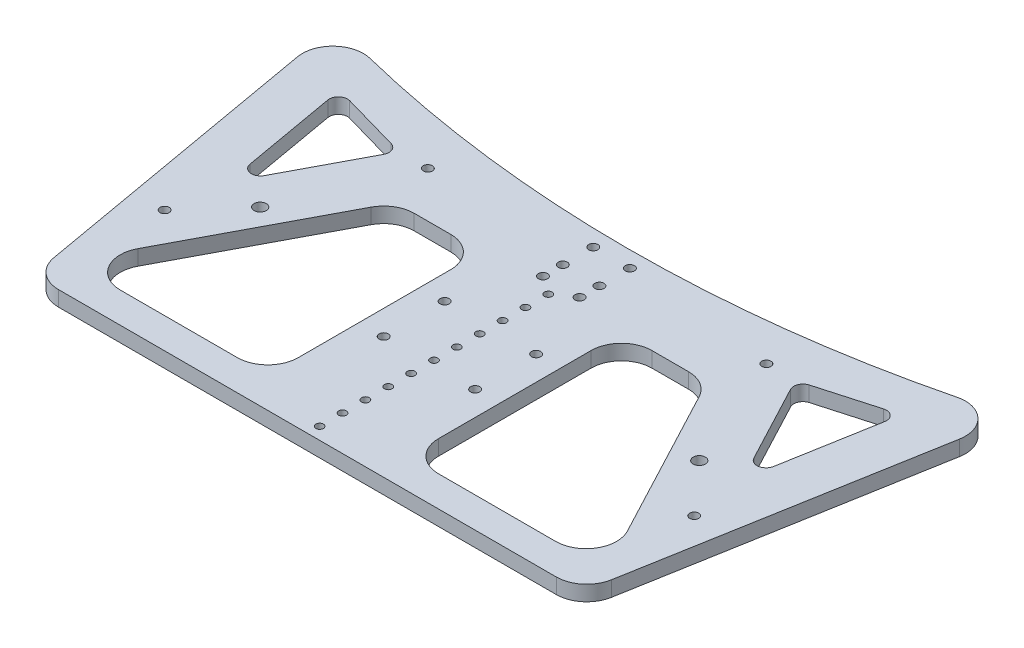
from build123d import *

# Parameters (mm, degrees)
SKETCH_1_R          = 2
EXTRUDE_1_DEPTH     = 5
SKETCH_2_R          = 1.5
CUT_EXTRUDE_1_DEPTH = 129.986884904
CUT_EXTRUDE_2_DEPTH = 3
CUT_EXTRUDE_3_DEPTH = 3
CUT_EXTRUDE_4_DEPTH = 129.986884904
FILLET_1_R          = 10
FILLET_2_R          = 10
FILLET_3_R          = 10
CUT_EXTRUDE_6_DEPTH = 127.770989194
FILLET_4_R          = 3
SKETCH_8_R          = 1.5
CUT_EXTRUDE_7_DEPTH = 127.770989194
SKETCH_9_R          = 1.25
CUT_EXTRUDE_8_DEPTH = 127.770989194
SKETCH_10_R         = 1.5
CUT_EXTRUDE_9_DEPTH = 127.770989194


with BuildPart() as part:
    # 草图1 → 凸台-拉伸1 (new body)
    # profile 1 of 3: a face of its own
    with BuildSketch(Plane(origin=(0, 0, 0), x_dir=(1, 0, 0), z_dir=(0, 1, 0))):
        with BuildLine():
            ThreePointArc((90, 50.256494602), (0, 40), (-90, 50.256494602))
            Line((-90, 50.256494602), (-90, -65))
            Line((-90, -65), (90, -65))
            Line((90, -65), (90, 50.256494602))
        make_face()
        with Locations(Location((-72, -8.5, 0), (0, 0, 270))):
            Circle(SKETCH_1_R, mode=Mode.SUBTRACT)
        with Locations(Location((72, -8.5, 0), (0, 0, 270))):
            Circle(SKETCH_1_R, mode=Mode.SUBTRACT)
    # profile 2 of 3: a face of its own
    with BuildSketch(Plane(origin=(0, 0, 0), x_dir=(1, 0, 0), z_dir=(0, 1, 0))):
        with BuildLine():
            Line((-90, -65), (-90, 50.256494602))
            ThreePointArc((-90, 50.256494602), (-100.687943549, 52.879943656), (-111.299669708, 55.796429581))
            Line((-111.299669708, 55.796429581), (-90, -65))
        make_face()
    # profile 3 of 3: a face of its own
    with BuildSketch(Plane(origin=(0, 0, 0), x_dir=(1, 0, 0), z_dir=(0, 1, 0))):
        with BuildLine():
            ThreePointArc((111.299669708, 55.796429581), (100.687943549, 52.879943656), (90, 50.256494602))
            Line((90, 50.256494602), (90, -65))
            Line((90, -65), (111.299669708, 55.796429581))
        make_face()
    extrude(amount=EXTRUDE_1_DEPTH)

    # 草图2 → 切除-拉伸1 (cut, through all)
    with BuildSketch(Plane(origin=(0, 0, 0), x_dir=(-1, 0, 0), z_dir=(0, -1, 0))):
        with Locations(Location((6, 18.25, 0), (0, 0, 90))):
            Circle(SKETCH_2_R)
        with Locations(Location((-6, 18.25, 0), (0, 0, 90))):
            Circle(SKETCH_2_R)
        with Locations(Location((6, 24.75, 0), (0, 0, 90))):
            Circle(SKETCH_2_R)
        with Locations(Location((-6, 24.75, 0), (0, 0, 90))):
            Circle(SKETCH_2_R)
        with Locations(Location((-6, 34.75, 0), (0, 0, 90))):
            Circle(SKETCH_2_R)
        with Locations(Location((6, 34.75, 0), (0, 0, 90))):
            Circle(SKETCH_2_R)
    extrude(amount=-CUT_EXTRUDE_1_DEPTH, mode=Mode.SUBTRACT)

    # 草图3 → 切除-拉伸2 (cut)
    with BuildSketch(Plane(origin=(0, 5, 0), x_dir=(1, 0, 0), z_dir=(0, 1, 0))):
        with BuildLine():
            ThreePointArc((-45, -46.5), (-40, -41.5), (-35, -46.5))
            Line((-35, -46.5), (-35, 8.5))
            ThreePointArc((-35, 8.5), (-40, 3.5), (-45, 8.5))
            Line((-45, 8.5), (-45, -46.5))
        make_face()
        with BuildLine():
            ThreePointArc((-45, 8.5), (-40, 3.5), (-35, 8.5))
            Line((-35, 8.5), (-45, 8.5))
        make_face()
        with BuildLine():
            Line((-45, 8.5), (-35, 8.5))
            ThreePointArc((-35, 8.5), (-40, 13.5), (-45, 8.5))
        make_face()
        with BuildLine():
            ThreePointArc((-45, -46.5), (-40, -51.5), (-35, -46.5))
            Line((-35, -46.5), (-45, -46.5))
        make_face()
        with BuildLine():
            Line((-45, -46.5), (-35, -46.5))
            ThreePointArc((-35, -46.5), (-40, -41.5), (-45, -46.5))
        make_face()
        with BuildLine():
            ThreePointArc((45, 8.5), (40, 3.5), (35, 8.5))
            Line((35, 8.5), (35, -46.5))
            ThreePointArc((35, -46.5), (40, -41.5), (45, -46.5))
            Line((45, -46.5), (45, 8.5))
        make_face()
        with BuildLine():
            ThreePointArc((45, -46.5), (40, -41.5), (35, -46.5))
            Line((35, -46.5), (45, -46.5))
        make_face()
        with BuildLine():
            Line((45, -46.5), (35, -46.5))
            ThreePointArc((35, -46.5), (40, -51.5), (45, -46.5))
        make_face()
        with BuildLine():
            ThreePointArc((45, 8.5), (40, 13.5), (35, 8.5))
            Line((35, 8.5), (45, 8.5))
        make_face()
        with BuildLine():
            Line((45, 8.5), (35, 8.5))
            ThreePointArc((35, 8.5), (40, 3.5), (45, 8.5))
        make_face()
    extrude(amount=-CUT_EXTRUDE_2_DEPTH, mode=Mode.SUBTRACT)

    # 草图4 → 切除-拉伸3 (cut)
    with BuildSketch(Plane(origin=(0, 5, 0), x_dir=(1, 0, 0), z_dir=(0, 1, 0))):
        with BuildLine():
            Line((45, -41.966401061), (45, -27.473665961))
            ThreePointArc((45, -27.473665961), (39.285969894, -12.835001066), (40.990143514, 2.78666473))
            Line((40.990143514, 2.78666473), (35, 4.966898668))
            Line((35, 4.966898668), (35, -30.4089023))
            ThreePointArc((35, -30.4089023), (39.482405618, -36.635494586), (45, -41.966401061))
        make_face()
        with BuildLine():
            Line((35, 4.966898668), (31.593217306, 6.206866163))
            ThreePointArc((31.593217306, 6.206866163), (29.1849194, -12.483575431), (35, -30.4089023))
            Line((35, -30.4089023), (35, 4.966898668))
        make_face()
        with BuildLine():
            Line((72, -51.5), (72, -41.5))
            ThreePointArc((72, -41.5), (56.787028178, -37.784219101), (45, -27.473665961))
            Line((45, -27.473665961), (45, -41.966401061))
            ThreePointArc((45, -41.966401061), (57.6831436, -49.046610497), (72, -51.5))
        make_face()
    extrude(amount=-CUT_EXTRUDE_3_DEPTH, mode=Mode.SUBTRACT)

    # 草图5 → 切除-拉伸4 (cut, through all)
    with BuildSketch(Plane(origin=(0, 5, 0), x_dir=(1, 0, 0), z_dir=(0, 1, 0))):
        Polygon((23, 15), (23, -55), (88, -55), (51, 15), align=None)
        Polygon((-88, -55), (-51, 15), (-23, 15), (-23, -55), align=None)
    extrude(amount=-CUT_EXTRUDE_4_DEPTH, mode=Mode.SUBTRACT)

    # 圆角1
    fillet_1_edges = [part.edges().sort_by_distance(p)[0] for p in [
        (23, 2.5, -15),
        (51, 2.5, -15),
        (88, 2.5, 55),
        (23, 2.5, 55),
        (-23, 2.5, 55),
        (-88, 2.5, 55),
        (-51, 2.5, -15),
        (-23, 2.5, -15),
    ]]
    fillet(fillet_1_edges, radius=FILLET_1_R)

    # 圆角2
    fillet_2_edges = [part.edges().sort_by_distance(p)[0] for p in [
        (90, 2.5, 65),
        (-90, 2.5, 65),
    ]]
    fillet(fillet_2_edges, radius=FILLET_2_R)

    # 圆角3
    fillet_3_edges = [part.edges().sort_by_distance(p)[0] for p in [
        (111.299669708, 2.5, -55.796429581),
        (-111.299669708, 2.5, -55.796429581),
    ]]
    fillet(fillet_3_edges, radius=FILLET_3_R)

    # 草图7 → 切除-拉伸6 (cut, through all)
    with BuildSketch(Plane(origin=(0, 5, 0), x_dir=(1, 0, 0), z_dir=(0, 1, 0))):
        Polygon((-65, 30), (-84.345864805, -6.600284766), (-92.1600328, 37.716064119), align=None)
        Polygon((84.345864805, -6.600284766), (92.1600328, 37.716064119), (65, 30), align=None)
    extrude(amount=-CUT_EXTRUDE_6_DEPTH, mode=Mode.SUBTRACT)

    # 圆角4
    fillet_4_edges = [part.edges().sort_by_distance(p)[0] for p in [
        (-92.1600328, 2.5, -37.716064119),
        (-65, 2.5, -30),
        (-84.345864805, 2.5, 6.600284766),
        (84.345864805, 2.5, 6.600284766),
        (65, 2.5, -30),
        (92.1600328, 2.5, -37.716064119),
    ]]
    fillet(fillet_4_edges, radius=FILLET_4_R)

    # 草图8 → 切除-拉伸7 (cut, through all)
    with BuildSketch(Plane(origin=(0, 0, 0), x_dir=(-1, 0, 0), z_dir=(0, -1, 0))):
        with Locations(Location((-55.513531222, 30, 0), (0, 0, 90))):
            Circle(SKETCH_8_R)
        with Locations(Location((-86.847160275, -25, 0), (0, 0, 90))):
            Circle(SKETCH_8_R)
        with Locations(Location((55.513531222, 30, 0), (0, 0, 90))):
            Circle(SKETCH_8_R)
        with Locations(Location((86.847160275, -25, 0), (0, 0, 90))):
            Circle(SKETCH_8_R)
    extrude(amount=-CUT_EXTRUDE_7_DEPTH, mode=Mode.SUBTRACT)

    # 草图9 → 切除-拉伸8 (cut, through all)
    with BuildSketch(Plane.XZ):
        with Locations(Location((0, -14, 0), (0, 0, 270))):
            Circle(SKETCH_9_R)
        with Locations(Location((0, -6.5, 0), (0, 0, 270))):
            Circle(SKETCH_9_R)
        with Locations(Location((0, 1, 0), (0, 0, 270))):
            Circle(SKETCH_9_R)
        with Locations(Location((0, 8.5, 0), (0, 0, 270))):
            Circle(SKETCH_9_R)
        with Locations(Location((0, 16, 0), (0, 0, 270))):
            Circle(SKETCH_9_R)
        with Locations(Location((0, 23.5, 0), (0, 0, 270))):
            Circle(SKETCH_9_R)
        with Locations(Location((0, 31, 0), (0, 0, 270))):
            Circle(SKETCH_9_R)
        with Locations(Location((0, 38.5, 0), (0, 0, 270))):
            Circle(SKETCH_9_R)
        with Locations(Location((0, 46, 0), (0, 0, 270))):
            Circle(SKETCH_9_R)
        with Locations(Location((0, 53.5, 0), (0, 0, 270))):
            Circle(SKETCH_9_R)
        with Locations(Location((0, 61, 0), (0, 0, 270))):
            Circle(SKETCH_9_R)
    extrude(amount=-CUT_EXTRUDE_8_DEPTH, mode=Mode.SUBTRACT)

    # 草图10 → 切除-拉伸9 (cut, through all)
    with BuildSketch(Plane.XZ):
        with Locations(Location((-15, 25, 0), (0, 0, 270))):
            Circle(SKETCH_10_R)
        with Locations(Location((-15, 5, 0), (0, 0, 270))):
            Circle(SKETCH_10_R)
        with Locations(Location((15, 5, 0), (0, 0, 90))):
            Circle(SKETCH_10_R)
        with Locations(Location((15, 25, 0), (0, 0, 90))):
            Circle(SKETCH_10_R)
    extrude(amount=-CUT_EXTRUDE_9_DEPTH, mode=Mode.SUBTRACT)


solid = part.part
